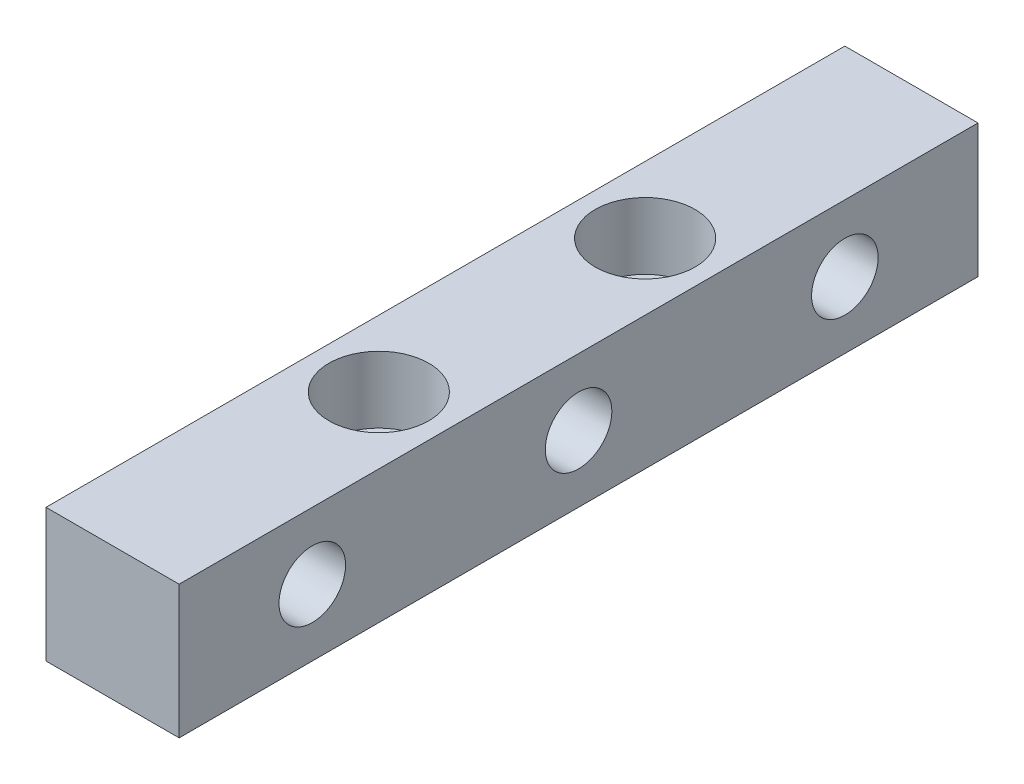
from build123d import *

# Parameters (mm, degrees)
SKETCH2_W                            = 12.7
SKETCH2_H                            = 12.7
BOSS_EXTRUDE1_DEPTH                  = 38.1
F_1_4_20_THREADED_C_BORE_D           = 6.35
F_1_4_20_THREADED_C_BORE_CBORE_D     = 9.525
F_1_4_20_THREADED_C_BORE_CBORE_DEPTH = 6.35
F_1_4_20_THREADED_HOLE_D             = 6.35


with BuildPart() as part:
    # Sketch2 → Boss-Extrude1 (new, symmetric)
    with BuildSketch(Plane.XY):
        Rectangle(SKETCH2_W, SKETCH2_H)
    extrude(amount=BOSS_EXTRUDE1_DEPTH, both=True)

    # 1/4"-20 threaded C-Bore (through all)
    with Locations(Plane(origin=(0, 6.35, 0), x_dir=(1, 0, 0), z_dir=(0, 1, 0))):
        with Locations((0, 12.7), (0, -12.7)):
            CounterBoreHole(F_1_4_20_THREADED_C_BORE_D / 2, F_1_4_20_THREADED_C_BORE_CBORE_D / 2, F_1_4_20_THREADED_C_BORE_CBORE_DEPTH)

    # 1/4"-20 threaded hole (through all)
    with Locations(Plane(origin=(6.35, 0, 0), x_dir=(0, 0, -1), z_dir=(1, 0, 0))):
        with Locations((-25.4, 0), (0, 0), (25.4, 0)):
            Hole(F_1_4_20_THREADED_HOLE_D / 2)


solid = part.part
